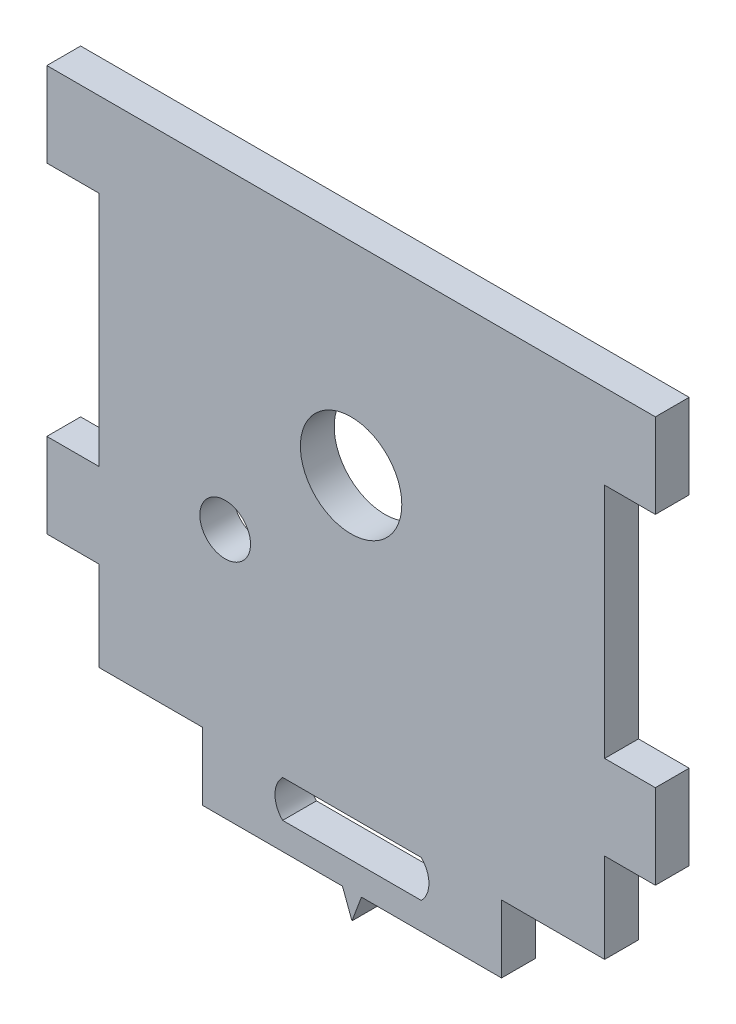
from build123d import *

# Parameters (mm, degrees)
SKETCH_1_R      = 3
SKETCH_1_R_2    = 1.5
EXTRUDE_1_DEPTH = 2


with BuildPart() as part:
    # 草图1 → 凸台-拉伸1 (new body)
    with BuildSketch(Plane.XY):
        Polygon((0, 0), (0, 5), (-3, 5), (-33, 5), (-36, 5), (-36, 0), (-33, 0), (-32.9, 0), (-32.9, -14), (-33, -14), (-36, -14), (-36, -19), (-33, -19), (-32.9, -19), (-32.9, -24.3), (-26.8, -24.3), (-26.8, -28.3), (-18.511559339, -28.3), (-17.95, -29.8), (-17.388440661, -28.3), (-9.1, -28.3), (-9.1, -24.3), (-3, -24.3), (-3, -19), (0, -19), (0, -14), (-3, -14), (-3, 0), align=None)
        with Locations((-18, -7)):
            Circle(SKETCH_1_R, mode=Mode.SUBTRACT)
        with Locations((-25.45, -13.5)):
            Circle(SKETCH_1_R_2, mode=Mode.SUBTRACT)
        with BuildLine():
            Line((-22.05, -24.5), (-13.85, -24.5))
            ThreePointArc((-13.85, -24.5), (-13.394365081, -25.6), (-13.85, -26.7))
            Line((-13.85, -26.7), (-22.05, -26.7))
            ThreePointArc((-22.05, -26.7), (-22.505634919, -25.6), (-22.05, -24.5))
        make_face(mode=Mode.SUBTRACT)
    extrude(amount=EXTRUDE_1_DEPTH)


solid = part.part
